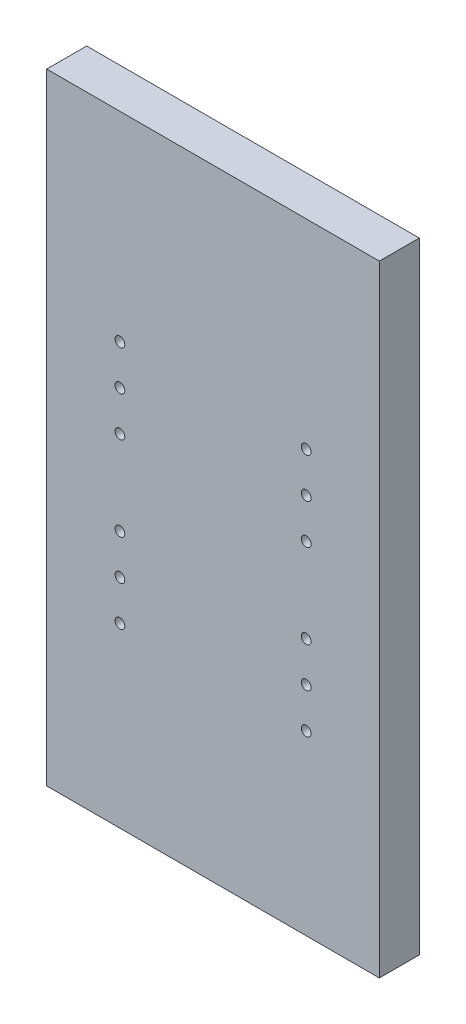
from build123d import *

# Parameters (mm, degrees)
BOSS_EXTRUDE1_DEPTH = 18
F_3DSKETCH2_R       = 2.2
CUT_EXTRUDE1_DEPTH  = 18


with BuildPart() as part:
    # 3DSketch1 → Boss-Extrude1 (new body)
    with BuildSketch(Plane(origin=(296.043137644, 1172.692882005, 0), x_dir=(-0.4722214125154188, -0.8814799700287822, 0), z_dir=(0, 0, 1))):
        Polygon((0, 0), (70.833211877, -132.221995504), (317.647603485, 0), (246.814391608, 132.221995504), align=None)
    extrude(amount=BOSS_EXTRUDE1_DEPTH)

    # 3DSketch2 → Cut-Extrude1 (cut)
    with BuildSketch(Plane(origin=(179.043137644, 1082.692882005, 21), x_dir=(0.6069136033622309, -0.7947678139267296, 0), z_dir=(0, 0, -1))):
        with Locations(Location((0, 0, 0), (0, 0, 127.366669413))):
            Circle(F_3DSKETCH2_R)
        with Locations(Location((14.305820651, 10.924444861, 0), (0, 0, 127.366669413))):
            Circle(F_3DSKETCH2_R)
        with Locations(Location((28.611641301, 21.848889721, 0), (0, 0, 127.366669413))):
            Circle(F_3DSKETCH2_R)
        with Locations(Location((58.812818231, 44.911606649, 0), (0, 0, 127.366669413))):
            Circle(F_3DSKETCH2_R)
        with Locations(Location((73.118638881, 55.836051509, 0), (0, 0, 127.366669413))):
            Circle(F_3DSKETCH2_R)
        with Locations(Location((87.424459532, 66.76049637, 0), (0, 0, 127.366669413))):
            Circle(F_3DSKETCH2_R)
        with Locations(Location((138.405202214, 0, 0), (0, 0, 127.366669413))):
            Circle(F_3DSKETCH2_R)
        with Locations(Location((124.099381564, -10.924444861, 0), (0, 0, 127.366669413))):
            Circle(F_3DSKETCH2_R)
        with Locations(Location((109.793560913, -21.848889721, 0), (0, 0, 127.366669413))):
            Circle(F_3DSKETCH2_R)
        with Locations(Location((79.592383984, -44.911606649, 0), (0, 0, 127.366669413))):
            Circle(F_3DSKETCH2_R)
        with Locations(Location((50.980742682, -66.76049637, 0), (0, 0, 127.366669413))):
            Circle(F_3DSKETCH2_R)
        with Locations(Location((65.286563333, -55.836051509, 0), (0, 0, 127.366669413))):
            Circle(F_3DSKETCH2_R)
    extrude(amount=CUT_EXTRUDE1_DEPTH, mode=Mode.SUBTRACT)


solid = part.part
